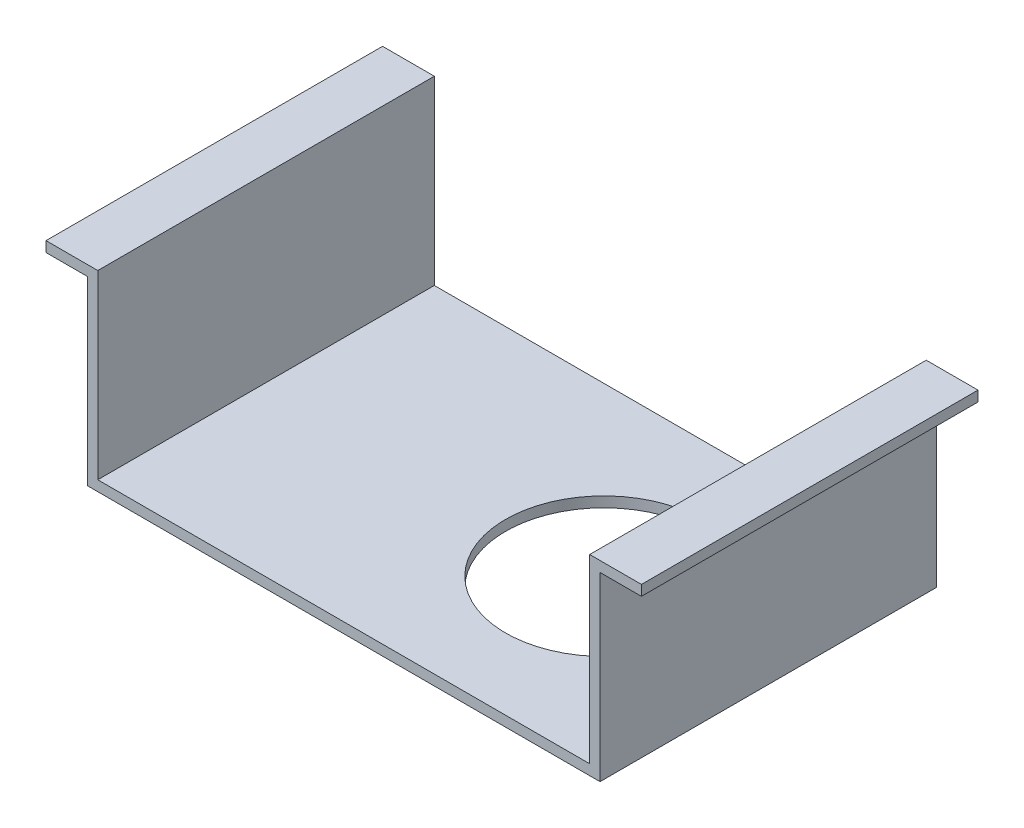
from build123d import *

# Parameters (mm, degrees)
BOSS_EXTRUDE1_DEPTH = 65
SKETCH2_R           = 19
CUT_EXTRUDE1_DEPTH  = 125.693619771


with BuildPart() as part:
    # Sketch1 → Boss-Extrude1 (new body)
    with BuildSketch(Plane.XY):
        Polygon((-15.227765327, 6.012341763), (-5.227765327, 6.012341763), (-5.227765327, -28.987658237), (89.772234673, -28.987658237), (89.772234673, 6.012341763), (99.772234673, 6.012341763), (99.772234673, 4.012341763), (91.772234673, 4.012341763), (91.772234673, -30.987658237), (-7.227765327, -30.987658237), (-7.227765327, 4.012341763), (-15.227765327, 4.012341763), align=None)
    extrude(amount=BOSS_EXTRUDE1_DEPTH)

    # Sketch2 → Cut-Extrude1 (cut, through all)
    with BuildSketch(Plane.XZ.offset(30.987658237)):
        with Locations((59.772234673, 32.253053016)):
            Circle(SKETCH2_R)
    extrude(amount=-CUT_EXTRUDE1_DEPTH, mode=Mode.SUBTRACT)


solid = part.part
